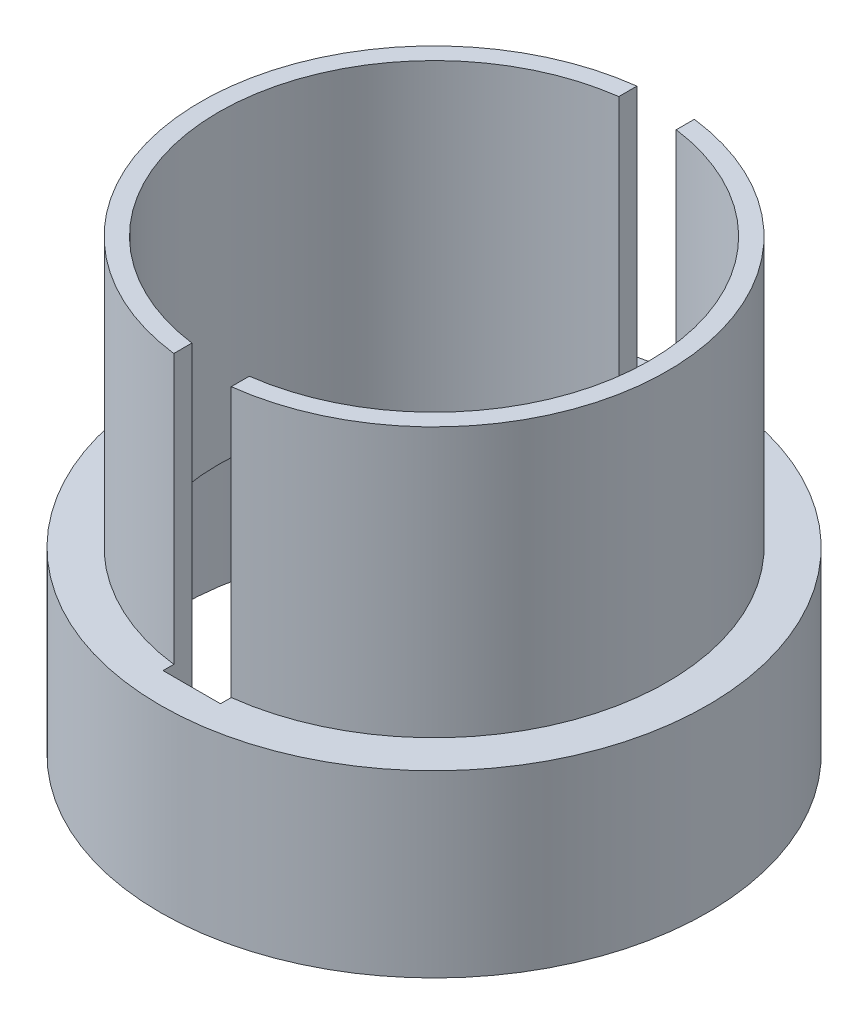
from build123d import *

# Parameters (mm, degrees)
SKETCH2_R           = 15.25
SKETCH2_R_2         = 14.25
BOSS_EXTRUDE1_DEPTH = 10
BOSS_EXTRUDE2_START = -2
SKETCH4_R           = 14.25
BOSS_EXTRUDE2_DEPTH = 2
SKETCH5_R           = 12
CUT_EXTRUDE1_DEPTH  = 2
BOSS_EXTRUDE4_START = 15
SKETCH6_R           = 13
SKETCH6_R_2         = 12
BOSS_EXTRUDE4_DEPTH = 15
CUT_EXTRUDE3_DEPTH  = 34.017041055


with BuildPart() as part:
    # Sketch2 → Boss-Extrude1 (new body)
    with BuildSketch(Plane(origin=(0, 0, 0), x_dir=(1, 0, 0), z_dir=(0, 1, 0))):
        with Locations(Location((0, 0, 0), (0, 0, 270))):
            Circle(SKETCH2_R)
        with Locations(Location((0, 0, 0), (0, 0, 270))):
            Circle(SKETCH2_R_2, mode=Mode.SUBTRACT)
    extrude(amount=BOSS_EXTRUDE1_DEPTH)

    # Sketch4 → Boss-Extrude2 (add)
    with BuildSketch(Plane(origin=(0, 10, 0), x_dir=(1, 0, 0), z_dir=(0, 1, 0)).offset(BOSS_EXTRUDE2_START)):
        with Locations(Location((0, 0, 0), (0, 0, 270))):
            Circle(SKETCH4_R)
    extrude(amount=BOSS_EXTRUDE2_DEPTH)

    # Sketch5 → Cut-Extrude1 (cut)
    with BuildSketch(Plane(origin=(0, 10, 0), x_dir=(1, 0, 0), z_dir=(0, 1, 0))):
        with Locations(Location((0, 0, 0), (0, 0, 270))):
            Circle(SKETCH5_R)
    extrude(amount=-CUT_EXTRUDE1_DEPTH, mode=Mode.SUBTRACT)

    # Sketch6 → Boss-Extrude4 (add)
    with BuildSketch(Plane(origin=(0, 10, 0), x_dir=(1, 0, 0), z_dir=(0, 1, 0)).offset(BOSS_EXTRUDE4_START)):
        with Locations(Location((0, 0, 0), (0, 0, 270))):
            Circle(SKETCH6_R)
        with Locations(Location((0, 0, 0), (0, 0, 270))):
            Circle(SKETCH6_R_2, mode=Mode.SUBTRACT)
    extrude(amount=-BOSS_EXTRUDE4_DEPTH)

    # Sketch7 → Cut-Extrude3 (cut, through all)
    with BuildSketch(Plane(origin=(0, 25, 0), x_dir=(1, 0, 0), z_dir=(0, 1, 0))):
        with BuildLine():
            ThreePointArc((-1.6, 12.901162738), (0, 13), (1.6, 12.901162738))
            Line((1.6, 12.901162738), (1.6, 13.5))
            Line((1.6, 13.5), (-1.6, 13.5))
            Line((-1.6, 13.5), (-1.6, 12.901162738))
        make_face()
        with BuildLine():
            ThreePointArc((-1.6, 11.892854998), (0, 12), (1.6, 11.892854998))
            Line((1.6, 11.892854998), (1.6, 12.901162738))
            ThreePointArc((1.6, 12.901162738), (0, 13), (-1.6, 12.901162738))
            Line((-1.6, 12.901162738), (-1.6, 11.892854998))
        make_face()
        with BuildLine():
            ThreePointArc((1.6, -12.901162738), (0.801524922, -12.975267157), (0, -13))
            Line((0, -13), (0, -13.5))
            Line((0, -13.5), (1.6, -13.5))
            Line((1.6, -13.5), (1.6, -12.901162738))
        make_face()
        with BuildLine():
            Line((0, -13.5), (0, -13))
            ThreePointArc((0, -13), (-0.801524922, -12.975267157), (-1.6, -12.901162738))
            Line((-1.6, -12.901162738), (-1.6, -13.5))
            Line((-1.6, -13.5), (0, -13.5))
        make_face()
        with BuildLine():
            Line((0, -13), (0, -12))
            ThreePointArc((0, -12), (-0.801791752, -11.973183787), (-1.6, -11.892854998))
            Line((-1.6, -11.892854998), (-1.6, -12.901162738))
            ThreePointArc((-1.6, -12.901162738), (-0.801524922, -12.975267157), (0, -13))
        make_face()
        with BuildLine():
            ThreePointArc((1.6, -11.892854998), (0.801791752, -11.973183787), (0, -12))
            Line((0, -12), (0, -13))
            ThreePointArc((0, -13), (0.801524922, -12.975267157), (1.6, -12.901162738))
            Line((1.6, -12.901162738), (1.6, -11.892854998))
        make_face()
    extrude(amount=-CUT_EXTRUDE3_DEPTH, mode=Mode.SUBTRACT)


solid = part.part
